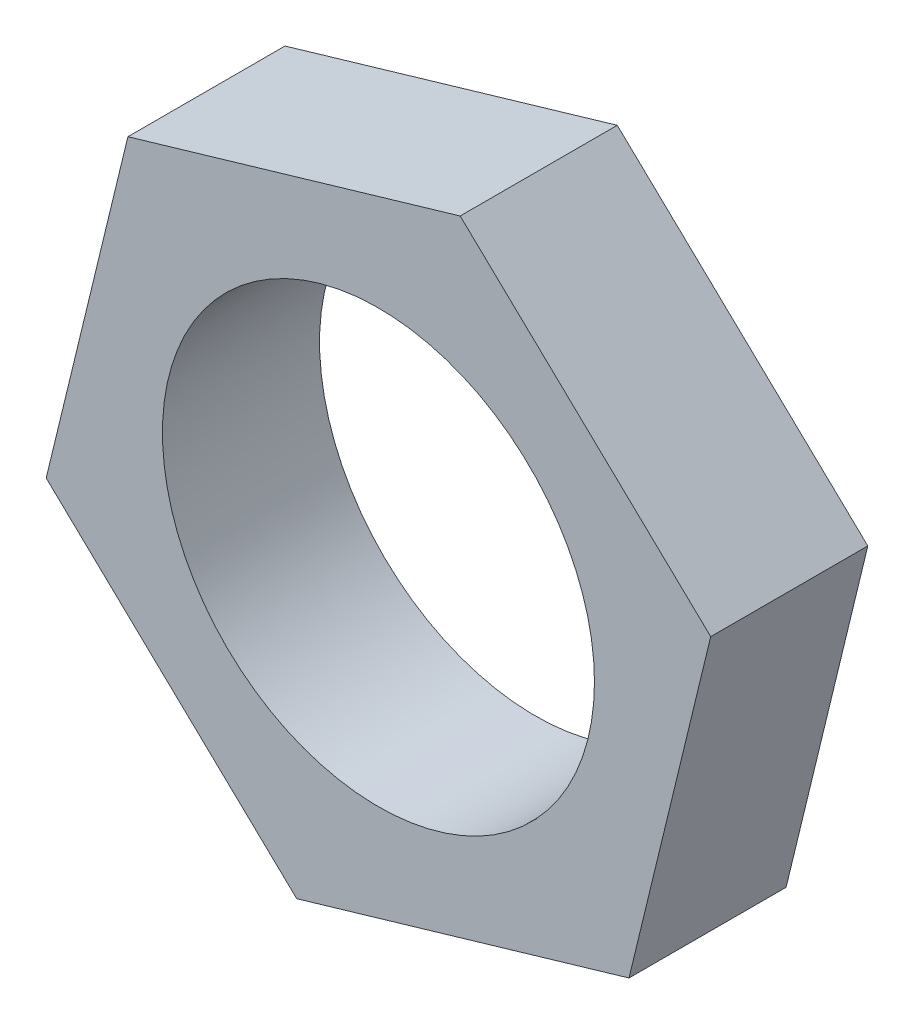
from build123d import *

# Parameters (mm, degrees)
CROQUIS1_R              = 5.5
SALIENTE_EXTRUIR1_DEPTH = 4


with BuildPart() as part:
    # Croquis1 → Saliente-Extruir1 (new body)
    with BuildSketch(Plane.XY):
        Polygon((2.080750103, 8.567708442), (-6.379478111, 6.085836669), (-8.460228214, -2.481871773), (-2.080750103, -8.567708442), (6.379478111, -6.085836669), (8.460228214, 2.481871773), align=None)
        Circle(CROQUIS1_R, mode=Mode.SUBTRACT)
    extrude(amount=-SALIENTE_EXTRUIR1_DEPTH)


solid = part.part
